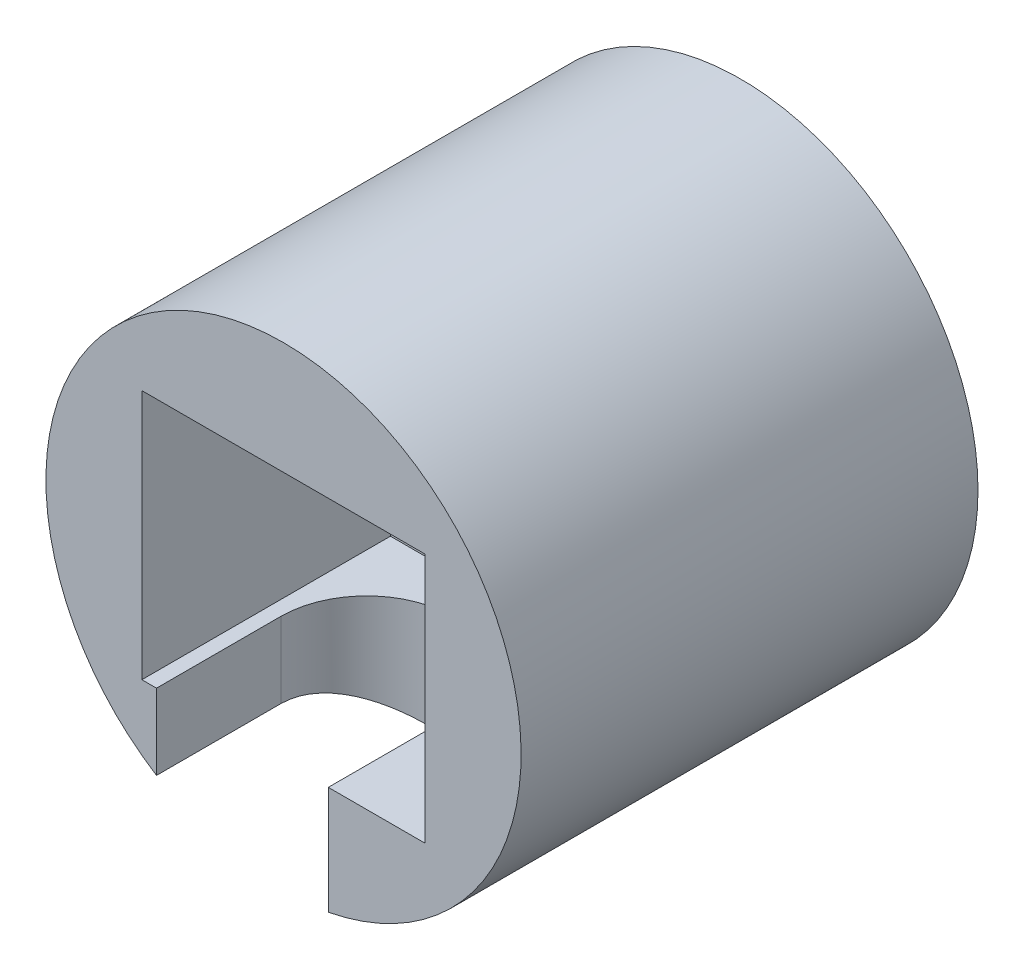
from build123d import *

# Parameters (mm, degrees)
SKETCH1_R               = 13
SKETCH1_R_2             = 3
BOSS_EXTRUDE1_DEPTH     = 25
SKETCH2_W               = 15.5
SKETCH2_H               = 13.6
CUT_EXTRUDE1_DEPTH      = 6.85
CUT_EXTRUDE2_REACH      = 33.032
CUT_EXTRUDE2_END_RADIUS = 13


with BuildPart() as part:
    # Sketch1 → Boss-Extrude1 (new body)
    with BuildSketch(Plane.XY):
        Circle(SKETCH1_R)
        Circle(SKETCH1_R_2, mode=Mode.SUBTRACT)
    extrude(amount=BOSS_EXTRUDE1_DEPTH)

    # Sketch2 → Cut-Extrude1 (cut, symmetric)
    with BuildSketch(Plane(origin=(0, 0, 0), x_dir=(1, 0, 0), z_dir=(0, 1, 0))):
        with Locations((0, -18.2)):
            Rectangle(SKETCH2_W, SKETCH2_H)
    extrude(amount=CUT_EXTRUDE1_DEPTH, both=True, mode=Mode.SUBTRACT)

    # Cut-Extrude2: up to this cylinder (the profile starts inside it)
    cut_extrude2_end = Plane(origin=(0, 0, 19.701869), z_dir=(0, 0, -1)) * Cylinder(CUT_EXTRUDE2_END_RADIUS, 93.064, mode=Mode.PRIVATE)
    # Sketch3 → Cut-Extrude2 (cut, up to the surface)
    with BuildSketch(Plane(origin=(0, 0, 0), x_dir=(1, 0, 0), z_dir=(0, 1, 0)), mode=Mode.PRIVATE) as cut_extrude2_sk1:
        with BuildLine():
            Line((-6.95, -18.2), (-6.95, -25))
            Line((-6.95, -25), (2.45, -25))
            Line((2.45, -25), (2.45, -18.2))
            ThreePointArc((2.45, -18.2), (-2.25, -13.5), (-6.95, -18.2))
        make_face()
    cut_extrude2_tool1 = extrude(cut_extrude2_sk1.sketch, amount=-CUT_EXTRUDE2_REACH, mode=Mode.PRIVATE) & cut_extrude2_end
    add(cut_extrude2_tool1.solids().sort_by_distance((-2.25, 0, 19.701869))[0], mode=Mode.SUBTRACT)


solid = part.part
